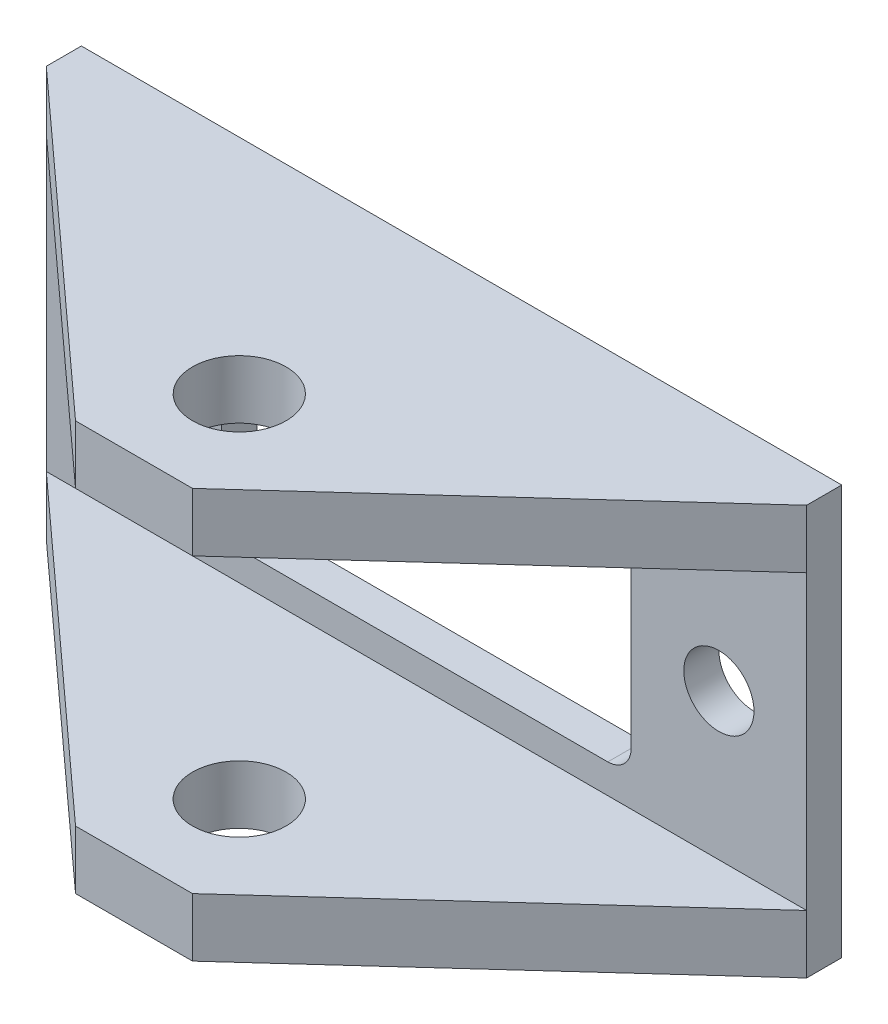
from build123d import *

# Parameters (mm, degrees)
BOSS_EXTRUDE1_DEPTH     = 35
CUT_EXTRUDE1_DEPTH      = 15.5
CUT_EXTRUDE1_DEPTH_BACK = 9.5
CUT_EXTRUDE2_DEPTH      = 51.214539727
CUT_EXTRUDE2_DEPTH_BACK = 51.214539727
SKETCH5_R               = 3
SKETCH5_W               = 35
SKETCH5_H               = 20
CUT_EXTRUDE3_DEPTH      = 51.214539727
CUT_EXTRUDE3_DEPTH_BACK = 51.214539727
SKETCH6_R               = 4
FILLET1_R               = 2


with BuildPart() as part:
    # Sketch1 → Boss-Extrude1 (new body)
    with BuildSketch(Plane(origin=(0, 0, 0), x_dir=(1, 0, 0), z_dir=(0, 1, 0))):
        Polygon((-32.5, 12.5), (32.5, 12.5), (32.5, 9.5), (5, -15.5), (-5, -15.5), (-32.5, 9.5), align=None)
    extrude(amount=BOSS_EXTRUDE1_DEPTH)

    # Sketch4 → Cut-Extrude1 (cut, two sides: drawn at the far end of the back side and taken through both)
    with BuildSketch(Plane.XY.offset(-CUT_EXTRUDE1_DEPTH_BACK)):
        Polygon((-23.214285714, 30), (23.214285714, 5), (32.5, 5), (32.5, 30), align=None)
        Polygon((-32.5, 5), (23.214285714, 5), (-23.214285714, 30), (-32.5, 30), align=None)
    extrude(amount=CUT_EXTRUDE1_DEPTH + CUT_EXTRUDE1_DEPTH_BACK, mode=Mode.SUBTRACT)

    # Sketch5 → Cut-Extrude2 (cut, two sides: drawn at the far end of the back side and taken through both)
    with BuildSketch(Plane.XY.offset(-CUT_EXTRUDE2_DEPTH_BACK)):
        with Locations((-25, 17.5)):
            Circle(SKETCH5_R)
        with Locations((25, 17.5)):
            Circle(SKETCH5_R)
        with Locations((0, 17.5)):
            Rectangle(SKETCH5_W, SKETCH5_H)
    extrude(amount=CUT_EXTRUDE2_DEPTH + CUT_EXTRUDE2_DEPTH_BACK, mode=Mode.SUBTRACT)

    # Sketch6 → Cut-Extrude3 (cut, two sides: drawn at the far end of the back side and taken through both)
    with BuildSketch(Plane(origin=(0, 35, 0), x_dir=(1, 0, 0), z_dir=(0, 1, 0)).offset(-CUT_EXTRUDE3_DEPTH_BACK)):
        with Locations(Location((0, -6.5, 0), (0, 0, 270))):
            Circle(SKETCH6_R)
    extrude(amount=CUT_EXTRUDE3_DEPTH + CUT_EXTRUDE3_DEPTH_BACK, mode=Mode.SUBTRACT)

    # Fillet1
    fillet1_edges = [part.edges().sort_by_distance(p)[0] for p in [
        (17.5, 27.5, -11),
        (17.5, 7.5, -11),
        (-17.5, 7.5, -11),
        (-17.5, 27.5, -11),
    ]]
    fillet(fillet1_edges, radius=FILLET1_R)


solid = part.part
